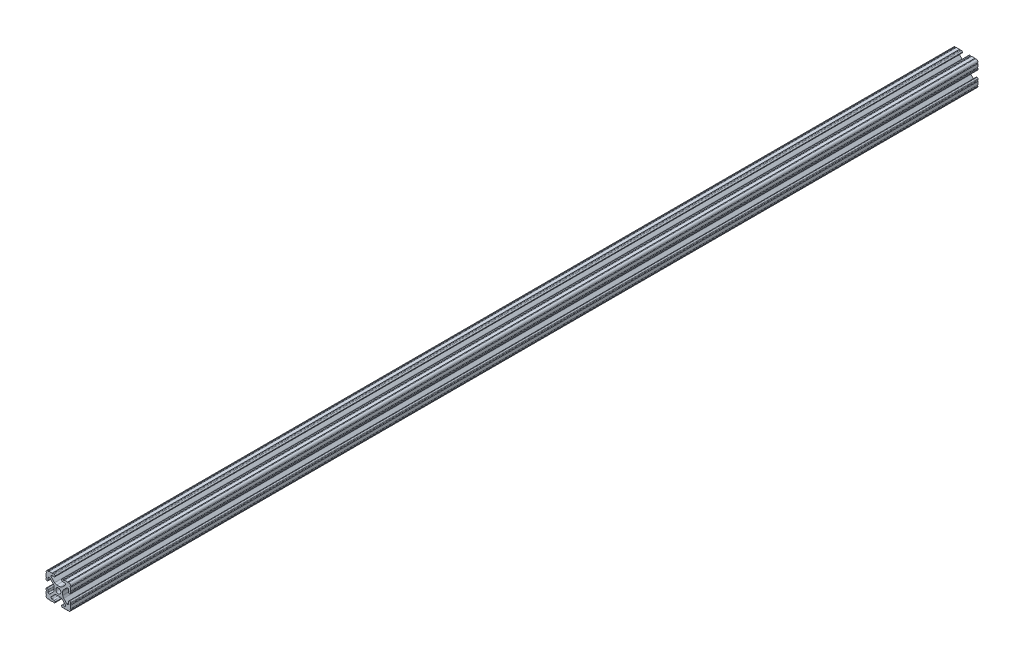
from build123d import *

# Parameters (mm, degrees)
SKETCH1_R               = 2.6035
BOSS_EXTRUDE1_DEPTH     = 466.725
CUT_EXTRUDE1_DEPTH      = 468.214777268
CUT_EXTRUDE1_DEPTH_BACK = 468.214777268
SKETCH2_R               = 3.175


with BuildPart() as part:
    # Sketch1 → Boss-Extrude1 (new, symmetric)
    with BuildSketch(Plane.XY):
        with BuildLine():
            Line((-7.179650497, -8.645192506), (-3.952270251, -5.423690499))
            ThreePointArc((-3.952270251, -5.423690499), (-2.922936451, -4.736929036), (-1.709253557, -4.4958))
            Line((-1.709253557, -4.4958), (1.709253557, -4.4958))
            ThreePointArc((1.709253557, -4.4958), (2.922936451, -4.736929036), (3.952270251, -5.423690499))
            Line((3.952270251, -5.423690499), (7.179650497, -8.645192506))
            ThreePointArc((7.179650497, -8.645192506), (7.41473083, -9.822813117), (6.416408329, -10.4902))
            Line((6.416408329, -10.4902), (4.287512407, -10.4902))
            ThreePointArc((4.287512407, -10.4902), (3.54574862, -10.79744862), (3.2385, -11.539212407))
            Line((3.2385, -11.539212407), (3.2385, -11.650987593))
            ThreePointArc((3.2385, -11.650987593), (3.54574862, -12.39275138), (4.287512407, -12.7))
            Line((4.287512407, -12.7), (5.317126718, -12.7))
            ThreePointArc((5.317126718, -12.7), (5.825126718, -12.192), (6.333126718, -12.7))
            Line((6.333126718, -12.7), (9.550443118, -12.7))
            ThreePointArc((9.550443118, -12.7), (10.058366869, -12.192000006), (10.566443095, -12.699847501))
            ThreePointArc((10.566443095, -12.699847501), (12.082537762, -12.08250727), (12.699846982, -10.566399977))
            ThreePointArc((12.699846982, -10.566399977), (12.192000006, -10.058323491), (12.7, -9.5504))
            Line((12.7, -9.5504), (12.7, -6.3330836))
            ThreePointArc((12.7, -6.3330836), (12.192, -5.8250836), (12.7, -5.3170836))
            Line((12.7, -5.3170836), (12.7, -4.287469289))
            ThreePointArc((12.7, -4.287469289), (12.39275138, -3.545705502), (11.650987593, -3.238456882))
            Line((11.650987593, -3.238456882), (11.539212407, -3.238456882))
            ThreePointArc((11.539212407, -3.238456882), (10.79744862, -3.545705502), (10.4902, -4.287469289))
            Line((10.4902, -4.287469289), (10.4902, -6.402089023))
            ThreePointArc((10.4902, -6.402089023), (9.856505071, -7.351067942), (8.737131347, -7.129408934))
            Line((8.737131347, -7.129408934), (5.441005833, -3.840816462))
            ThreePointArc((5.441005833, -3.840816462), (4.750877967, -2.809883091), (4.5085, -1.593185507))
            Line((4.5085, -1.593185507), (4.5085, 1.593185507))
            ThreePointArc((4.5085, 1.593185507), (4.750877967, 2.809883091), (5.441005833, 3.840816462))
            Line((5.441005833, 3.840816462), (8.737131347, 7.129408934))
            ThreePointArc((8.737131347, 7.129408934), (9.856505071, 7.351067942), (10.4902, 6.402089023))
            Line((10.4902, 6.402089023), (10.4902, 4.287469289))
            ThreePointArc((10.4902, 4.287469289), (10.79744862, 3.545705502), (11.539212407, 3.238456882))
            Line((11.539212407, 3.238456882), (11.650987593, 3.238456882))
            ThreePointArc((11.650987593, 3.238456882), (12.39275138, 3.545705502), (12.7, 4.287469289))
            Line((12.7, 4.287469289), (12.7, 5.3170836))
            ThreePointArc((12.7, 5.3170836), (12.192, 5.8250836), (12.7, 6.3330836))
            Line((12.7, 6.3330836), (12.7, 9.5504))
            ThreePointArc((12.7, 9.5504), (12.192000006, 10.058323491), (12.699846982, 10.566399977))
            ThreePointArc((12.699846982, 10.566399977), (12.082537762, 12.08250727), (10.566443095, 12.699847501))
            ThreePointArc((10.566443095, 12.699847501), (10.058366869, 12.192000006), (9.550443118, 12.7))
            Line((9.550443118, 12.7), (6.333126718, 12.7))
            ThreePointArc((6.333126718, 12.7), (5.825126718, 12.192), (5.317126718, 12.7))
            Line((5.317126718, 12.7), (4.287512407, 12.7))
            ThreePointArc((4.287512407, 12.7), (3.54574862, 12.39275138), (3.2385, 11.650987593))
            Line((3.2385, 11.650987593), (3.2385, 11.539212407))
            ThreePointArc((3.2385, 11.539212407), (3.54574862, 10.79744862), (4.287512407, 10.4902))
            Line((4.287512407, 10.4902), (6.476788598, 10.4902))
            ThreePointArc((6.476788598, 10.4902), (7.432222385, 9.85140422), (7.207036008, 8.724370562))
            Line((7.207036008, 8.724370562), (3.898272566, 5.423169045))
            ThreePointArc((3.898272566, 5.423169045), (2.869120213, 4.736787962), (1.655778399, 4.4958))
            Line((1.655778399, 4.4958), (-1.655778399, 4.4958))
            ThreePointArc((-1.655778399, 4.4958), (-2.869120213, 4.736787962), (-3.898272566, 5.423169045))
            Line((-3.898272566, 5.423169045), (-7.207036008, 8.724370562))
            ThreePointArc((-7.207036008, 8.724370562), (-7.432222385, 9.85140422), (-6.476788598, 10.4902))
            Line((-6.476788598, 10.4902), (-4.287512407, 10.4902))
            ThreePointArc((-4.287512407, 10.4902), (-3.54574862, 10.79744862), (-3.2385, 11.539212407))
            Line((-3.2385, 11.539212407), (-3.2385, 11.650987593))
            ThreePointArc((-3.2385, 11.650987593), (-3.54574862, 12.39275138), (-4.287512407, 12.7))
            Line((-4.287512407, 12.7), (-5.317126718, 12.7))
            ThreePointArc((-5.317126718, 12.7), (-5.825126718, 12.192), (-6.333126718, 12.7))
            Line((-6.333126718, 12.7), (-9.550443118, 12.7))
            ThreePointArc((-9.550443118, 12.7), (-10.058366869, 12.192000006), (-10.566443095, 12.699847501))
            ThreePointArc((-10.566443095, 12.699847501), (-12.082537762, 12.08250727), (-12.699846982, 10.566399977))
            ThreePointArc((-12.699846982, 10.566399977), (-12.192000006, 10.058323491), (-12.7, 9.5504))
            Line((-12.7, 9.5504), (-12.7, 6.3330836))
            ThreePointArc((-12.7, 6.3330836), (-12.192, 5.8250836), (-12.7, 5.3170836))
            Line((-12.7, 5.3170836), (-12.7, 4.287469289))
            ThreePointArc((-12.7, 4.287469289), (-12.39275138, 3.545705502), (-11.650987593, 3.238456882))
            Line((-11.650987593, 3.238456882), (-11.539212407, 3.238456882))
            ThreePointArc((-11.539212407, 3.238456882), (-10.79744862, 3.545705502), (-10.4902, 4.287469289))
            Line((-10.4902, 4.287469289), (-10.4902, 6.402089023))
            ThreePointArc((-10.4902, 6.402089023), (-9.856505071, 7.351067942), (-8.737131347, 7.129408934))
            Line((-8.737131347, 7.129408934), (-5.441005833, 3.840816462))
            ThreePointArc((-5.441005833, 3.840816462), (-4.750877967, 2.809883091), (-4.5085, 1.593185507))
            Line((-4.5085, 1.593185507), (-4.5085, -1.593185507))
            ThreePointArc((-4.5085, -1.593185507), (-4.750877967, -2.809883091), (-5.441005833, -3.840816462))
            Line((-5.441005833, -3.840816462), (-8.737131347, -7.129408934))
            ThreePointArc((-8.737131347, -7.129408934), (-9.856505071, -7.351067942), (-10.4902, -6.402089023))
            Line((-10.4902, -6.402089023), (-10.4902, -4.287469289))
            ThreePointArc((-10.4902, -4.287469289), (-10.79744862, -3.545705502), (-11.539212407, -3.238456882))
            Line((-11.539212407, -3.238456882), (-11.650987593, -3.238456882))
            ThreePointArc((-11.650987593, -3.238456882), (-12.39275138, -3.545705502), (-12.7, -4.287469289))
            Line((-12.7, -4.287469289), (-12.7, -5.3170836))
            ThreePointArc((-12.7, -5.3170836), (-12.192, -5.8250836), (-12.7, -6.3330836))
            Line((-12.7, -6.3330836), (-12.7, -9.5504))
            ThreePointArc((-12.7, -9.5504), (-12.192000006, -10.058323491), (-12.699846982, -10.566399977))
            ThreePointArc((-12.699846982, -10.566399977), (-12.082537762, -12.08250727), (-10.566443095, -12.699847501))
            ThreePointArc((-10.566443095, -12.699847501), (-10.058366869, -12.192000006), (-9.550443118, -12.7))
            Line((-9.550443118, -12.7), (-6.333126718, -12.7))
            ThreePointArc((-6.333126718, -12.7), (-5.825126718, -12.192), (-5.317126718, -12.7))
            Line((-5.317126718, -12.7), (-4.287512407, -12.7))
            ThreePointArc((-4.287512407, -12.7), (-3.54574862, -12.39275138), (-3.2385, -11.650987593))
            Line((-3.2385, -11.650987593), (-3.2385, -11.539212407))
            ThreePointArc((-3.2385, -11.539212407), (-3.54574862, -10.79744862), (-4.287512407, -10.4902))
            Line((-4.287512407, -10.4902), (-6.416408329, -10.4902))
            ThreePointArc((-6.416408329, -10.4902), (-7.41473083, -9.822813117), (-7.179650497, -8.645192506))
        make_face()
        Circle(SKETCH1_R, mode=Mode.SUBTRACT)
    extrude(amount=BOSS_EXTRUDE1_DEPTH, both=True)

    # Sketch2 → Cut-Extrude1 (cut, two sides: drawn at the far end of the back side and taken through both)
    with BuildSketch(Plane(origin=(4.5085, 0, 0), x_dir=(0, 0, -1), z_dir=(1, 0, 0)).offset(-CUT_EXTRUDE1_DEPTH_BACK)):
        with Locations(Location((-231.775, 0, 0), (0, 0, 149.881456627))):
            Circle(SKETCH2_R)
        with Locations(Location((231.775, 0, 0), (0, 0, 149.881456627))):
            Circle(SKETCH2_R)
        with Locations(Location((-85.725, 0, 0), (0, 0, 149.881456627))):
            Circle(SKETCH2_R)
        with Locations(Location((85.725, 0, 0), (0, 0, 149.881456627))):
            Circle(SKETCH2_R)
    extrude(amount=CUT_EXTRUDE1_DEPTH + CUT_EXTRUDE1_DEPTH_BACK, mode=Mode.SUBTRACT)


solid = part.part
